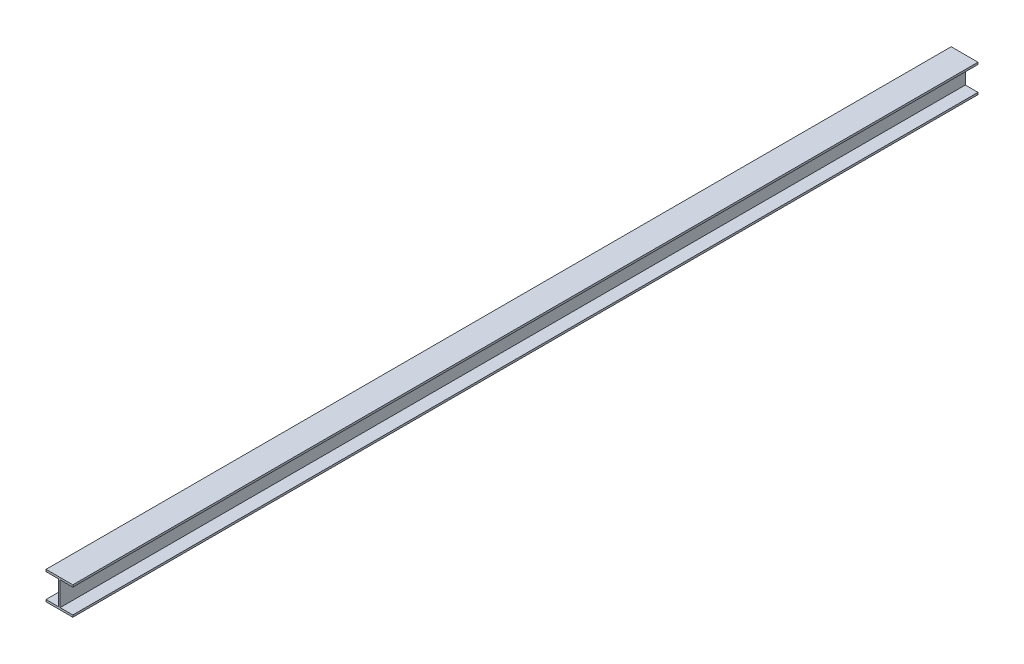
from build123d import *

# Parameters (mm, degrees)
BOSS_EXTRUDE1_DEPTH = 5214.4


with BuildPart() as part:
    # Sketch1 → Boss-Extrude1 (new body)
    with BuildSketch(Plane.XY):
        Polygon((0, -0.000240533), (154.432, -0.000240533), (154.432, -11.557240533), (81.28, -11.557240533), (81.28, -150.495240533), (154.432, -150.495240533), (154.432, -162.052240533), (0, -162.052240533), (0, -150.495240533), (73.152, -150.495240533), (73.152, -11.557240533), (0, -11.557240533), align=None)
    extrude(amount=BOSS_EXTRUDE1_DEPTH)


solid = part.part
